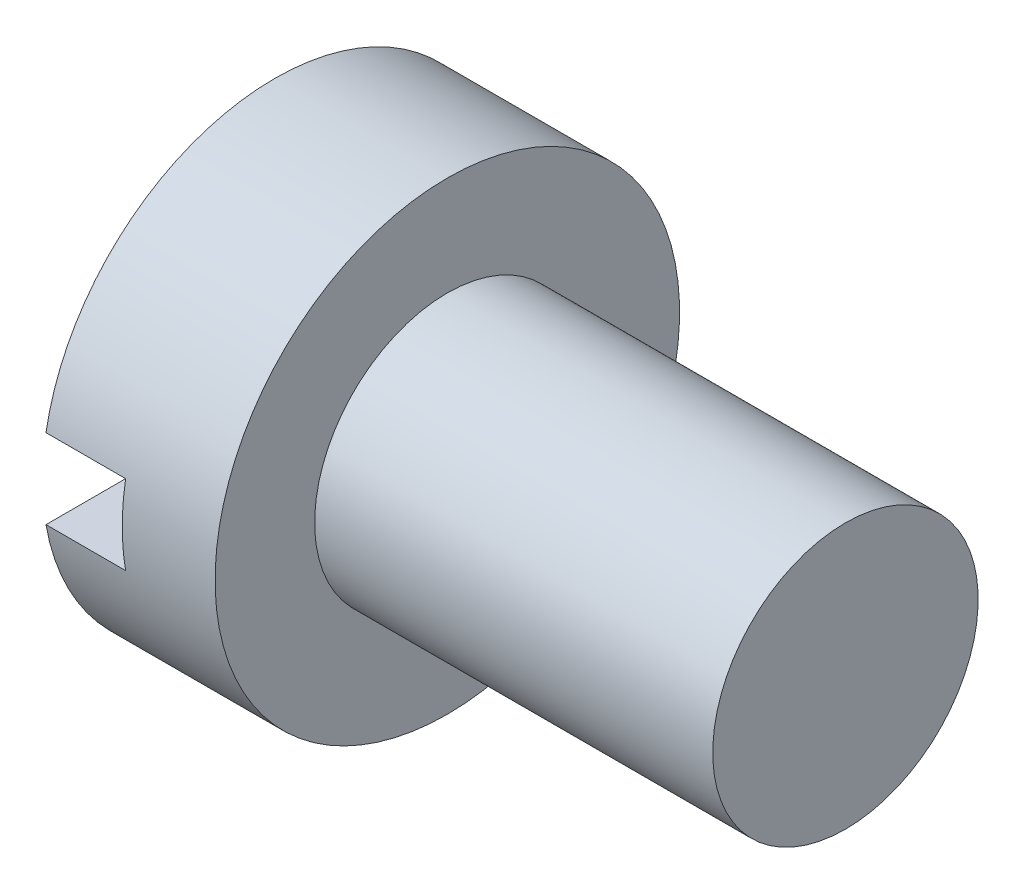
from build123d import *

# Parameters (mm, degrees)
SKETCH2_W          = 7
SKETCH2_H          = 1.2
CUT_EXTRUDE1_DEPTH = 1.2


with BuildPart() as part:
    # Sketch1 → Revolve1 (revolve)
    with BuildSketch(Plane.XY):
        Polygon((0, 0), (0, 3.5), (2.6, 3.5), (2.6, 2), (8.6, 2), (8.6, 0), align=None)
    revolve(axis=Axis((8.6, 0, 0), (-1, 0, 0)))

    # Sketch2 → Cut-Extrude1 (cut)
    with BuildSketch(Plane.ZY):
        Rectangle(SKETCH2_W, SKETCH2_H)
    extrude(amount=-CUT_EXTRUDE1_DEPTH, mode=Mode.SUBTRACT)


solid = part.part
